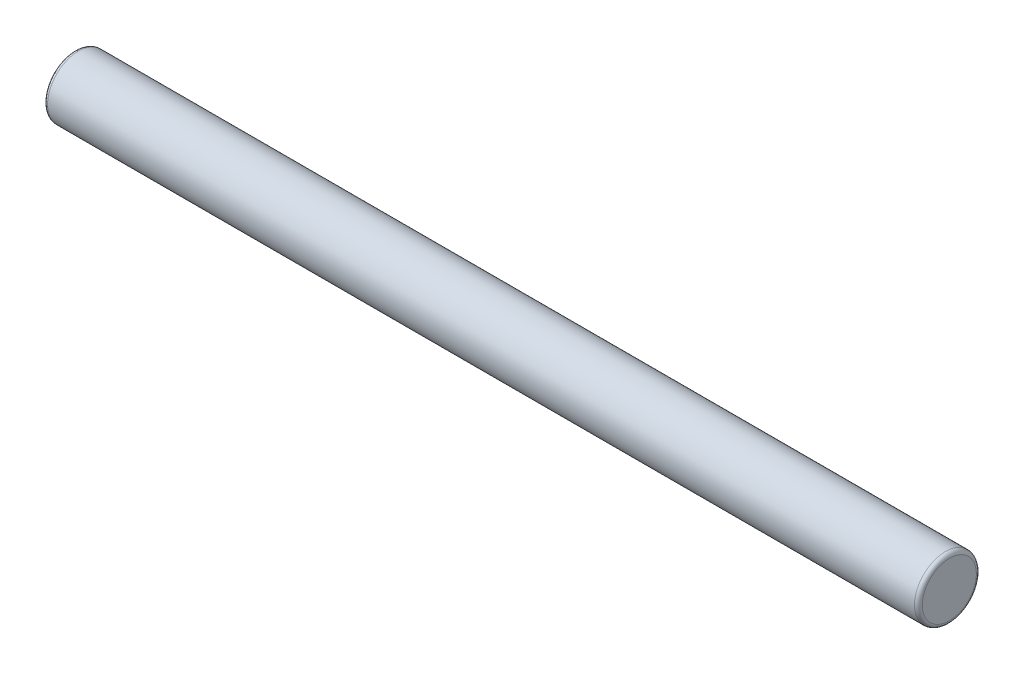
from build123d import *

# Parameters (mm, degrees)
SKETCH1_R           = 4
BOSS_EXTRUDE1_DEPTH = 113
FILLET1_R           = 0.508


with BuildPart() as part:
    # Sketch1 → Boss-Extrude1 (new body)
    with BuildSketch(Plane(origin=(0, 0, 0), x_dir=(0, 0, -1), z_dir=(1, 0, 0))):
        Circle(SKETCH1_R)
    extrude(amount=BOSS_EXTRUDE1_DEPTH)

    # Fillet1
    fillet1_edges = [part.edges().sort_by_distance(p)[0] for p in [
        (0, 0, 4),
        (113, 0, 4),
    ]]
    fillet(fillet1_edges, radius=FILLET1_R)


solid = part.part
